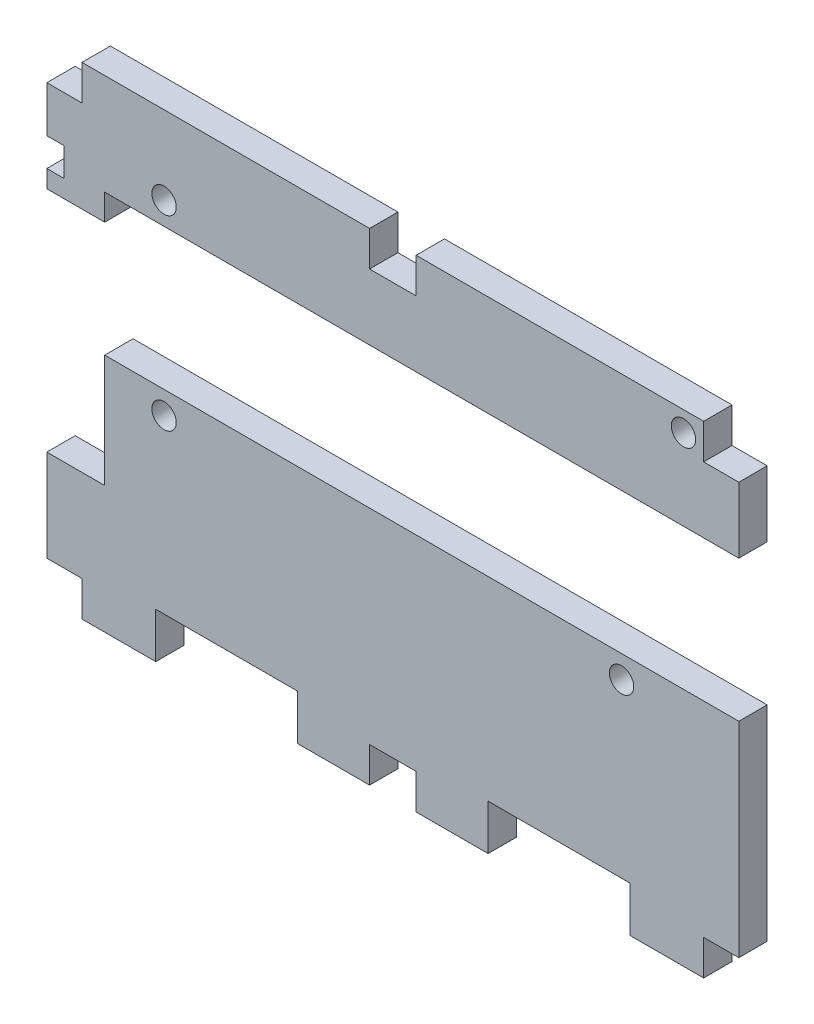
from build123d import *

# Parameters (mm, degrees)
SKETCH_1_W          = 122
SKETCH_1_H          = 85
EXTRUDE_1_DEPTH     = 5
SKETCH_2_W          = 8.2
SKETCH_2_H          = 6.2
SKETCH_2_W_2        = 6.2
SKETCH_2_W_3        = 10.2
SKETCH_2_H_2        = 40.2
CUT_EXTRUDE_1_DEPTH = 5
SKETCH_6_R          = 2.15
CUT_EXTRUDE_2_DEPTH = 5
SKETCH_8_W          = 111.8
SKETCH_8_H          = 24.893
SKETCH_8_W_2        = 25
SKETCH_8_H_2        = 8
CUT_EXTRUDE_5_DEPTH = 5
SKETCH_9_W          = 3
SKETCH_9_H          = 5
CUT_EXTRUDE_6_DEPTH = 5


with BuildPart() as part:
    # 草图1 → 凸台-拉伸1 (new body)
    with BuildSketch(Plane.XY):
        Rectangle(SKETCH_1_W, SKETCH_1_H)
    extrude(amount=EXTRUDE_1_DEPTH)

    # 草图2 → 切除-拉伸1 (cut)
    with BuildSketch(Plane.XY.offset(5)):
        with Locations((0, 39.4)):
            Rectangle(SKETCH_2_W, SKETCH_2_H)
        with Locations((-57.9, 39.4)):
            Rectangle(SKETCH_2_W_2, SKETCH_2_H)
        with Locations((57.9, 39.4)):
            Rectangle(SKETCH_2_W_2, SKETCH_2_H)
        with Locations((57.9, -39.4)):
            Rectangle(SKETCH_2_W_2, SKETCH_2_H)
        with Locations((0, -39.4)):
            Rectangle(SKETCH_2_W, SKETCH_2_H)
        with Locations((-57.9, -39.4)):
            Rectangle(SKETCH_2_W_2, SKETCH_2_H)
        with Locations((-55.9, 0)):
            Rectangle(SKETCH_2_W_3, SKETCH_2_H_2)
    extrude(amount=-CUT_EXTRUDE_1_DEPTH, mode=Mode.SUBTRACT)

    # 草图6 → 切除-拉伸2 (cut)
    with BuildSketch(Plane(origin=(0, 0, 0), x_dir=(-1, 0, 0), z_dir=(0, 0, -1))):
        with Locations((-51.244, 38.982)):
            Circle(SKETCH_6_R)
        with Locations((-40.322, -4.198)):
            Circle(SKETCH_6_R)
        with Locations((40.33, 28.695)):
            Circle(SKETCH_6_R)
        with Locations((40.331, -4.198)):
            Circle(SKETCH_6_R)
    extrude(amount=-CUT_EXTRUDE_2_DEPTH, mode=Mode.SUBTRACT)

    # 草图8 → 切除-拉伸5 (cut)
    with BuildSketch(Plane(origin=(0, 0, 0), x_dir=(-1, 0, 0), z_dir=(0, 0, -1))):
        with Locations((-5.1, 12.2485)):
            Rectangle(SKETCH_8_W, SKETCH_8_H)
        with Locations((-29.3, -38.5)):
            Rectangle(SKETCH_8_W_2, SKETCH_8_H_2)
        with Locations((29.3, -38.5)):
            Rectangle(SKETCH_8_W_2, SKETCH_8_H_2)
    extrude(amount=-CUT_EXTRUDE_5_DEPTH, mode=Mode.SUBTRACT)


with BuildPart() as cut_extrude_5_piece_1:
    # of the separate pieces the step leaves, piece 1, a body of its own (cut_extrude_5_pieces)
    add(part.part.solids().sort_by_distance((-50.8, -0.198, 0))[0])


with BuildPart() as cut_extrude_5_piece_2:
    # of the separate pieces the step leaves, piece 2, a body of its own (cut_extrude_5_pieces)
    add(part.part.solids().sort_by_distance((-54.8, 42.5, 0))[0])

    # 草图9 → 切除-拉伸6 (cut)
    with BuildSketch(Plane(origin=(0, 0, 0), x_dir=(-1, 0, 0), z_dir=(0, 0, -1))):
        with Locations((59.5, 25.7)):
            Rectangle(SKETCH_9_W, SKETCH_9_H)
    extrude(amount=-CUT_EXTRUDE_6_DEPTH, mode=Mode.SUBTRACT)


solid = Compound([cut_extrude_5_piece_1.part, cut_extrude_5_piece_2.part])
